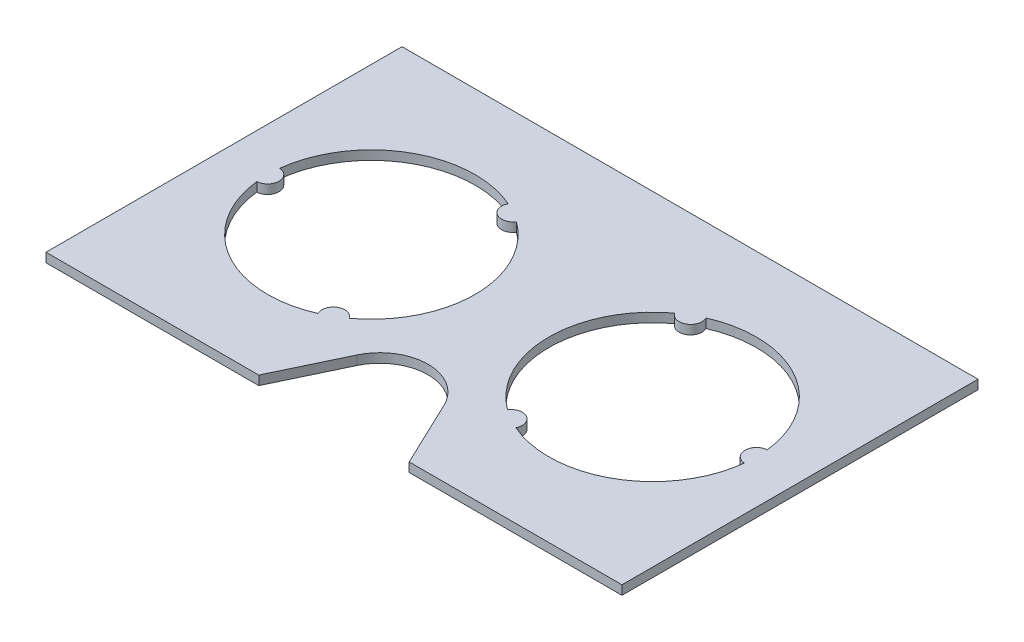
from build123d import *

# Parameters (mm, degrees)
EXTRUDE_1_DEPTH = 2


with BuildPart() as part:
    # 草图1 → 凸台-拉伸1 (new body)
    with BuildSketch(Plane(origin=(0, 0, 0), x_dir=(1, 0, 0), z_dir=(0, 1, 0))):
        with BuildLine():
            Line((0, 0), (125.7, 0))
            Line((125.7, 0), (125.7, -77.7))
            Line((125.7, -77.7), (79.265, -77.7))
            Line((79.265, -77.7), (72.35, -63.178332735))
            ThreePointArc((72.35, -63.178332735), (62.85, -57.18), (53.35, -63.178332735))
            Line((53.35, -63.178332735), (46.435, -77.7))
            Line((46.435, -77.7), (0, -77.7))
            Line((0, -77.7), (0, 0))
        make_face()
        with BuildLine():
            ThreePointArc((9.647969095, -36.353809997), (20.835, -19.234524604), (41.254251498, -18.105914344))
            ThreePointArc((41.254251498, -18.105914344), (42.235, -21.399588114), (45.577779407, -20.602104347))
            ThreePointArc((45.577779407, -20.602104347), (54.81, -38.85), (45.577779407, -57.097895653))
            ThreePointArc((45.577779407, -57.097895653), (42.235, -56.300411886), (41.254251498, -59.594085656))
            ThreePointArc((41.254251498, -59.594085656), (20.835, -58.465475396), (9.647969095, -41.346190003))
            ThreePointArc((9.647969095, -41.346190003), (12.01, -38.85), (9.647969095, -36.353809997))
        make_face(mode=Mode.SUBTRACT)
        with BuildLine():
            ThreePointArc((80.122220593, -57.097895653), (83.465, -56.300411886), (84.445748502, -59.594085656))
            ThreePointArc((84.445748502, -59.594085656), (104.865, -58.465475396), (116.052030905, -41.346190003))
            ThreePointArc((116.052030905, -41.346190003), (113.69, -38.85), (116.052030905, -36.353809997))
            ThreePointArc((116.052030905, -36.353809997), (104.865, -19.234524604), (84.445748502, -18.105914344))
            ThreePointArc((84.445748502, -18.105914344), (83.465, -21.399588114), (80.122220593, -20.602104347))
            ThreePointArc((80.122220593, -20.602104347), (70.89, -38.85), (80.122220593, -57.097895653))
        make_face(mode=Mode.SUBTRACT)
    extrude(amount=EXTRUDE_1_DEPTH)


solid = part.part
